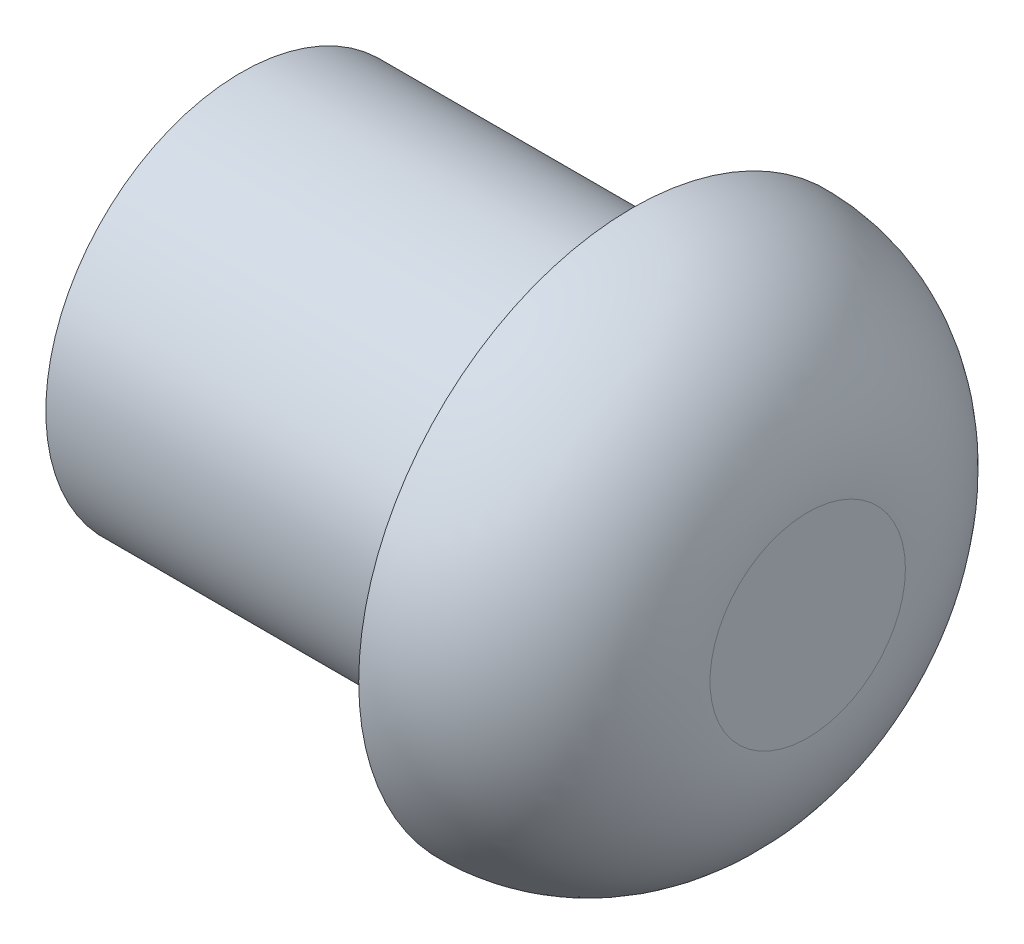
from build123d import *


with BuildPart() as part:
    # Sketch1 → Revolve1 (revolve)
    with BuildSketch(Plane.XY, mode=Mode.PRIVATE) as revolve1_sk:
        with BuildLine():
            Line((-24.878204537, 0), (25.121795463, 0))
            Line((25.121795463, 0), (25.121795463, -9.971098266))
            ThreePointArc((25.121795463, -9.971098266), (41.011261427, -3.389465965), (47.592893729, 12.5))
            Line((47.592893729, 12.5), (47.592893729, 25))
            Line((47.592893729, 25), (35.092893729, 25))
            Line((35.092893729, 25), (-24.878204537, 25))
            Line((-24.878204537, 25), (-24.878204537, 0))
        make_face()
    revolve(revolve1_sk.sketch.rotate(Axis((47.592893729, 25, 0), (-1, 0, 0)), 270), axis=Axis((47.592893729, 25, 0), (-1, 0, 0)))


solid = part.part
